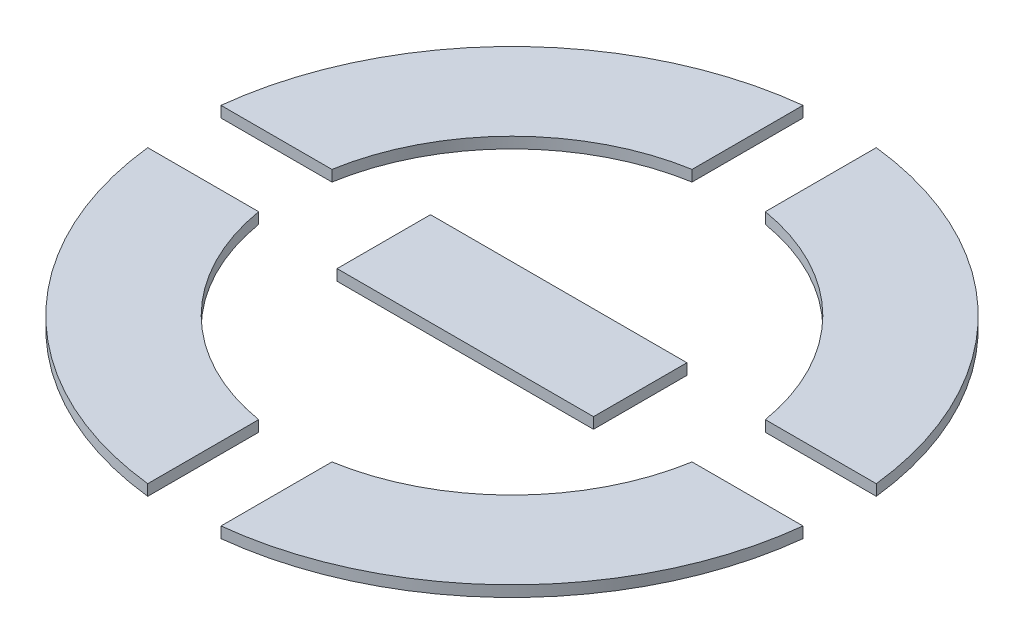
from build123d import *

# Parameters (mm, degrees)
BOSS_EXTRUDE1_DEPTH   = 3
BOSS_EXTRUDE1_2_DEPTH = 3
BOSS_EXTRUDE1_3_DEPTH = 3
BOSS_EXTRUDE1_4_DEPTH = 3
SKETCH1_W             = 70
SKETCH1_H             = 25.5
BOSS_EXTRUDE1_5_DEPTH = 3


with BuildPart() as part:
    # Sketch1 → Boss-Extrude1 (new body)
    with BuildSketch(Plane(origin=(0, 0, 0), x_dir=(1, 0, 0), z_dir=(0, 1, 0))):
        with BuildLine():
            Line((-10, 59.160797831), (-10, 89.4427191))
            ThreePointArc((-10, 89.4427191), (-63.639610307, 63.639610307), (-89.4427191, 10))
            Line((-89.4427191, 10), (-59.160797831, 10))
            ThreePointArc((-59.160797831, 10), (-42.426406871, 42.426406871), (-10, 59.160797831))
        make_face()
    extrude(amount=BOSS_EXTRUDE1_DEPTH)


with BuildPart() as body_2:
    # Sketch1 → Boss-Extrude1 2 (new body)
    with BuildSketch(Plane(origin=(0, 0, 0), x_dir=(1, 0, 0), z_dir=(0, 1, 0))):
        with BuildLine():
            Line((10, 59.160797831), (10, 89.4427191))
            ThreePointArc((10, 89.4427191), (63.639610307, 63.639610307), (89.4427191, 10))
            Line((89.4427191, 10), (59.160797831, 10))
            ThreePointArc((59.160797831, 10), (42.426406871, 42.426406871), (10, 59.160797831))
        make_face()
    extrude(amount=BOSS_EXTRUDE1_2_DEPTH)


with BuildPart() as body_3:
    # Sketch1 → Boss-Extrude1 3 (new body)
    with BuildSketch(Plane(origin=(0, 0, 0), x_dir=(1, 0, 0), z_dir=(0, 1, 0))):
        with BuildLine():
            Line((10, -59.160797831), (10, -89.4427191))
            ThreePointArc((10, -89.4427191), (63.639610307, -63.639610307), (89.4427191, -10))
            Line((89.4427191, -10), (59.160797831, -10))
            ThreePointArc((59.160797831, -10), (42.426406871, -42.426406871), (10, -59.160797831))
        make_face()
    extrude(amount=BOSS_EXTRUDE1_3_DEPTH)


with BuildPart() as body_4:
    # Sketch1 → Boss-Extrude1 4 (new body)
    with BuildSketch(Plane(origin=(0, 0, 0), x_dir=(1, 0, 0), z_dir=(0, 1, 0))):
        with BuildLine():
            Line((-10, -59.160797831), (-10, -89.4427191))
            ThreePointArc((-10, -89.4427191), (-63.639610307, -63.639610307), (-89.4427191, -10))
            Line((-89.4427191, -10), (-59.160797831, -10))
            ThreePointArc((-59.160797831, -10), (-42.426406871, -42.426406871), (-10, -59.160797831))
        make_face()
    extrude(amount=BOSS_EXTRUDE1_4_DEPTH)


with BuildPart() as body_5:
    # Sketch1 → Boss-Extrude1 5 (new body)
    with BuildSketch(Plane(origin=(0, 0, 0), x_dir=(1, 0, 0), z_dir=(0, 1, 0))):
        Rectangle(SKETCH1_W, SKETCH1_H)
    extrude(amount=BOSS_EXTRUDE1_5_DEPTH)


solid = Compound([part.part, body_2.part, body_3.part, body_4.part, body_5.part])
